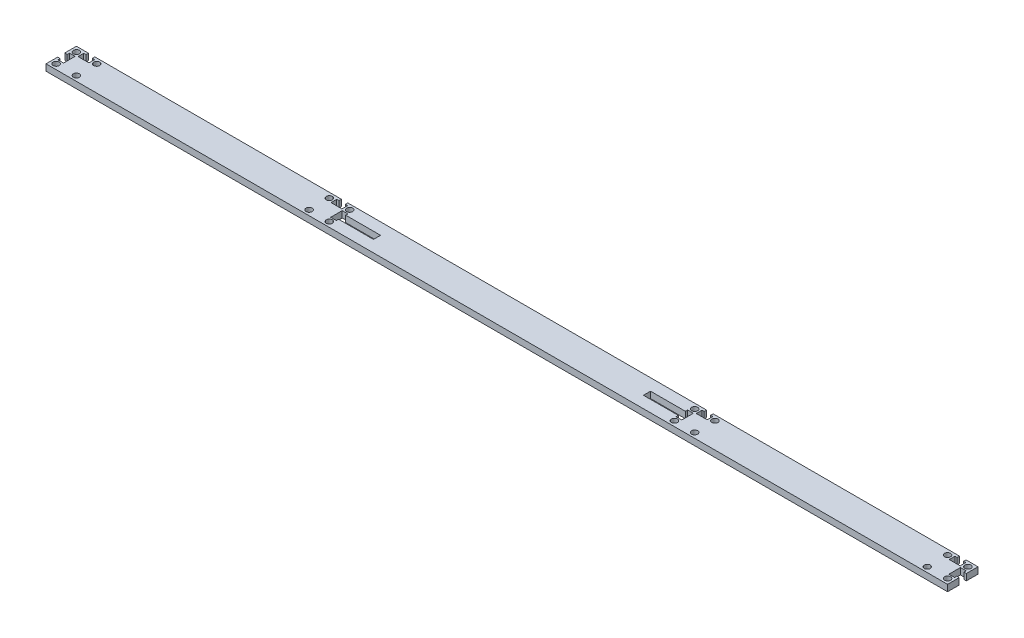
from build123d import *

# Parameters (mm, degrees)
SKETCH1_R           = 1.5
BOSS_EXTRUDE1_DEPTH = 3.175
CUT_EXTRUDE19_DEPTH = 445.76435404


with BuildPart() as part:
    # Sketch1 → Boss-Extrude1 (new body)
    with BuildSketch(Plane(origin=(0, 0, 0), x_dir=(1, 0, 0), z_dir=(0, 1, 0))):
        Polygon((0, 7.5), (0, 0), (444.5, 0), (444.5, 15), (0, 15), align=None)
        with Locations(Location((2.5, 2.5, 0), (0, 0, 270))):
            Circle(SKETCH1_R, mode=Mode.SUBTRACT)
        with Locations(Location((12.5, 2.5, 0), (0, 0, 270))):
            Circle(SKETCH1_R, mode=Mode.SUBTRACT)
        with Locations(Location((127.2, 2.5, 0), (0, 0, 270))):
            Circle(SKETCH1_R, mode=Mode.SUBTRACT)
        with Locations(Location((137.2, 2.5, 0), (0, 0, 270))):
            Circle(SKETCH1_R, mode=Mode.SUBTRACT)
        with Locations(Location((2.5, 12.5, 0), (0, 0, 270))):
            Circle(SKETCH1_R, mode=Mode.SUBTRACT)
        with Locations(Location((12.5, 12.5, 0), (0, 0, 270))):
            Circle(SKETCH1_R, mode=Mode.SUBTRACT)
        with Locations(Location((127.2, 12.5, 0), (0, 0, 270))):
            Circle(SKETCH1_R, mode=Mode.SUBTRACT)
        with Locations(Location((137.2, 12.5, 0), (0, 0, 270))):
            Circle(SKETCH1_R, mode=Mode.SUBTRACT)
        with Locations(Location((442, 12.5, 0), (0, 0, 270))):
            Circle(SKETCH1_R, mode=Mode.SUBTRACT)
        with Locations(Location((307.3, 2.5, 0), (0, 0, 270))):
            Circle(SKETCH1_R, mode=Mode.SUBTRACT)
        with Locations(Location((317.3, 2.5, 0), (0, 0, 270))):
            Circle(SKETCH1_R, mode=Mode.SUBTRACT)
        with Locations(Location((432, 2.5, 0), (0, 0, 270))):
            Circle(SKETCH1_R, mode=Mode.SUBTRACT)
        with Locations(Location((442, 2.5, 0), (0, 0, 270))):
            Circle(SKETCH1_R, mode=Mode.SUBTRACT)
        with Locations(Location((307.3, 12.5, 0), (0, 0, 270))):
            Circle(SKETCH1_R, mode=Mode.SUBTRACT)
        with Locations(Location((317.3, 12.5, 0), (0, 0, 270))):
            Circle(SKETCH1_R, mode=Mode.SUBTRACT)
        with Locations(Location((432, 12.5, 0), (0, 0, 270))):
            Circle(SKETCH1_R, mode=Mode.SUBTRACT)
    extrude(amount=BOSS_EXTRUDE1_DEPTH)

    # Sketch23 → Cut-Extrude19 (cut, through all)
    with BuildSketch(Plane(origin=(0, 3.175, 0), x_dir=(1, 0, 0), z_dir=(0, 1, 0))):
        Polygon((444.5, 7.5), (444.5, 9.25), (443.3, 9.25), (443.3, 10.35), (440.5, 10.35), (440.5, 4.65), (443.3, 4.65), (443.3, 5.75), (444.5, 5.75), align=None)
        Polygon((437, 15), (435.416405275, 15), (435.416405275, 13.8), (434.316405275, 13.8), (434.316405275, 11), (439.695743789, 11), (439.695743789, 13.8), (438.595743789, 13.8), (438.595743789, 15), align=None)
        Polygon((306, 5.75), (306, 4.65), (308.8, 4.65), (308.8, 10.35), (306, 10.35), (306, 9.25), (304.8, 9.25), (288.8, 9.25), (288.8, 5.75), (304.8, 5.75), align=None)
        Polygon((312.3, 15), (310.704256211, 15), (310.704256211, 13.8), (309.604256211, 13.8), (309.604256211, 11), (314.983594725, 11), (314.983594725, 13.8), (313.883594725, 13.8), (313.883594725, 15), align=None)
        Polygon((135.7, 4.65), (138.5, 4.65), (138.5, 5.75), (139.7, 5.75), (155.7, 5.75), (155.7, 9.25), (139.7, 9.25), (138.5, 9.25), (138.5, 10.35), (135.7, 10.35), align=None)
        Polygon((132.2, 15), (130.616405275, 15), (130.616405275, 13.8), (129.516405275, 13.8), (129.516405275, 11), (134.895743789, 11), (134.895743789, 13.8), (133.795743789, 13.8), (133.795743789, 15), align=None)
        Polygon((7.5, 15), (5.904256211, 15), (5.904256211, 13.8), (4.804256211, 13.8), (4.804256211, 11), (10.183594725, 11), (10.183594725, 13.8), (9.083594725, 13.8), (9.083594725, 15), align=None)
        Polygon((0, 9.25), (0, 7.5), (0, 5.75), (1.2, 5.75), (1.2, 4.65), (4, 4.65), (4, 10.35), (1.2, 10.35), (1.2, 9.25), align=None)
    extrude(amount=-CUT_EXTRUDE19_DEPTH, mode=Mode.SUBTRACT)


solid = part.part
